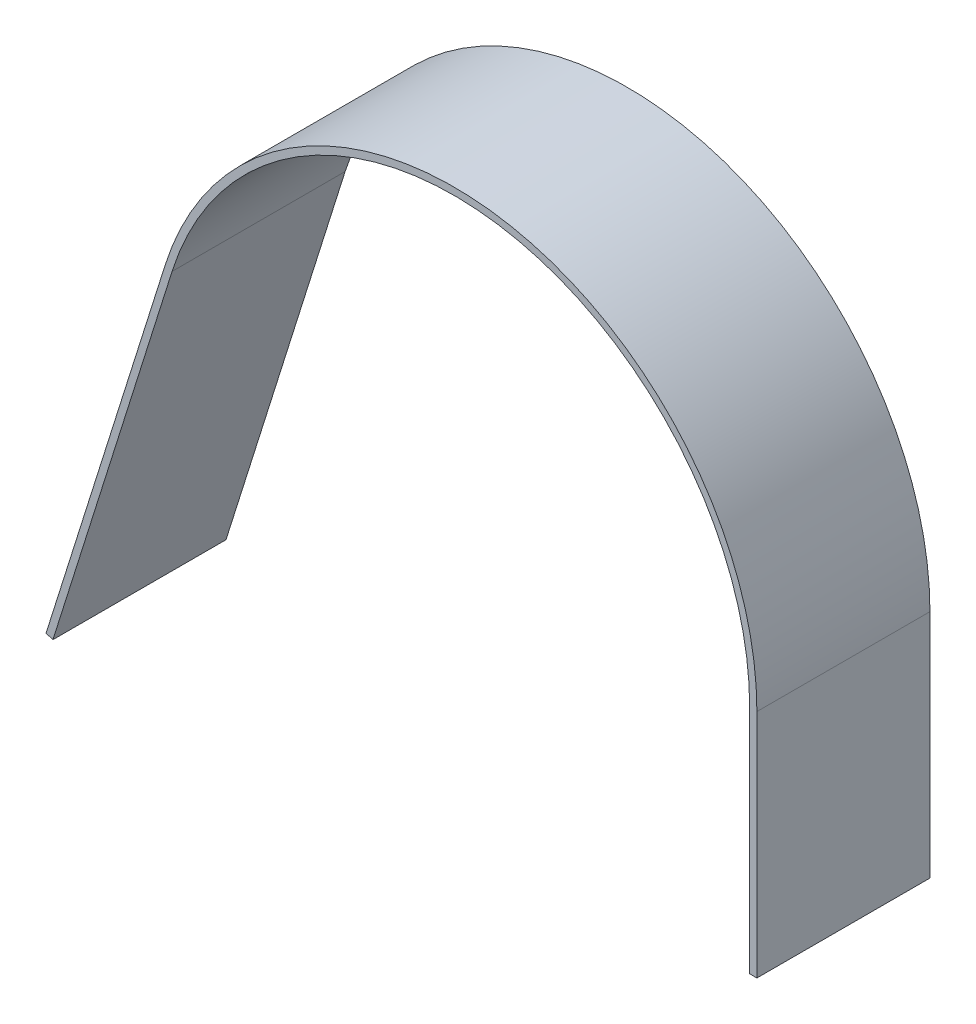
from build123d import *

# Parameters (mm, degrees)
BOSS_EXTRUDE1_DEPTH = 76.2


with BuildPart() as part:
    # Sketch2 → Boss-Extrude1 (new body)
    with BuildSketch(Plane.XY):
        with BuildLine():
            Line((0, 0), (0, 101.6))
            ThreePointArc((0, 101.6), (-113.095249414, 233.402760133), (-260.546945312, 141.639475562))
            Line((-260.546945312, 141.639475562), (-313.011392851, -25.028977778))
            Line((-313.011392851, -25.028977778), (-309.982894153, -25.982298625))
            Line((-309.982894153, -25.982298625), (-257.518446614, 140.686154715))
            ThreePointArc((-257.518446614, 140.686154715), (-113.57750538, 230.264599177), (-3.175, 101.6))
            Line((-3.175, 101.6), (-3.175, 0))
            Line((-3.175, 0), (0, 0))
        make_face()
    extrude(amount=BOSS_EXTRUDE1_DEPTH)


solid = part.part
